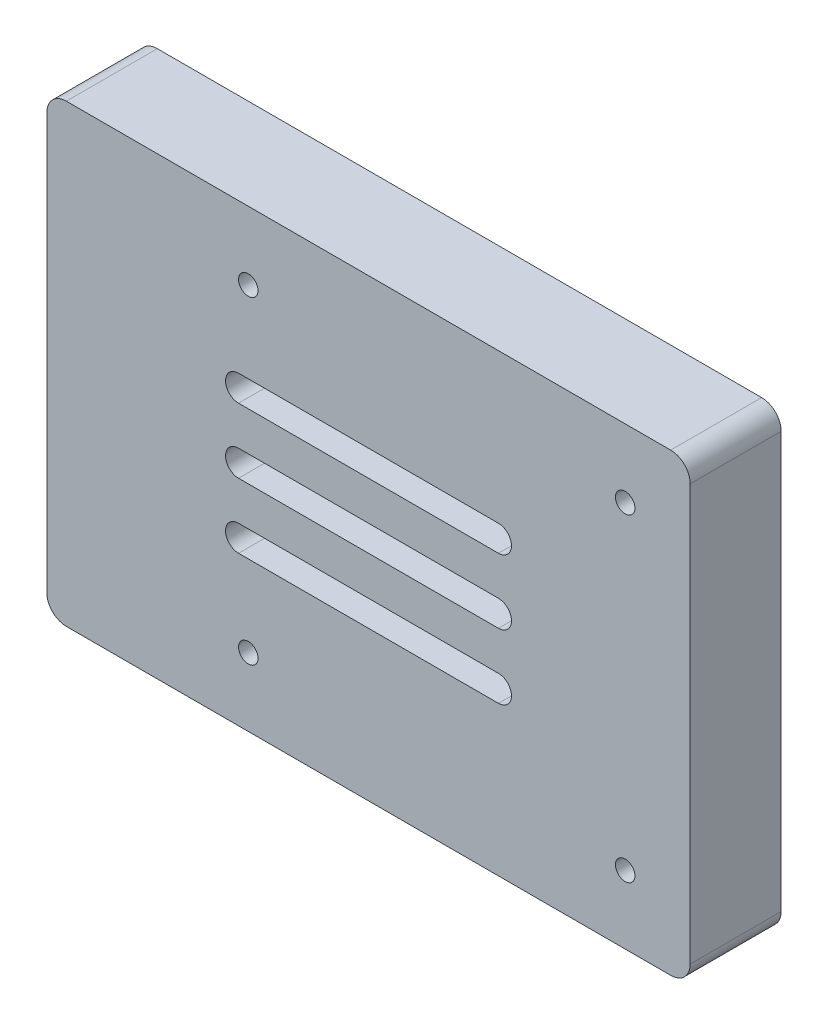
from build123d import *

# Parameters (mm, degrees)
BOSS_EXTRU_1_DEPTH      = 10
BOSS_EXTRU_2_START      = 10
BOSS_EXTRU_2_DEPTH      = 4
ESQUISSE3_R             = 1.5
ENL_V_MAT_EXTRU_1_DEPTH = 63.219369974
ENL_V_MAT_EXTRU_2_DEPTH = 5


with BuildPart() as part:
    # Esquisse1 → Boss.-Extru.1 (new body)
    with BuildSketch(Plane.XY):
        with BuildLine():
            Line((-46.5, -35), (46.5, -35))
            ThreePointArc((46.5, -35), (48.621320344, -34.121320344), (49.5, -32))
            Line((49.5, -32), (49.5, 32))
            ThreePointArc((49.5, 32), (48.621320344, 34.121320344), (46.5, 35))
            Line((46.5, 35), (-46.5, 35))
            ThreePointArc((-46.5, 35), (-48.621320344, 34.121320344), (-49.5, 32))
            Line((-49.5, 32), (-49.5, -32))
            ThreePointArc((-49.5, -32), (-48.621320344, -34.121320344), (-46.5, -35))
        make_face()
        with BuildLine():
            ThreePointArc((44.5, -33), (46.621320344, -32.121320344), (47.5, -30))
            Line((47.5, -30), (47.5, 30))
            ThreePointArc((47.5, 30), (46.621320344, 32.121320344), (44.5, 33))
            Line((44.5, 33), (-44.5, 33))
            ThreePointArc((-44.5, 33), (-46.621320344, 32.121320344), (-47.5, 30))
            Line((-47.5, 30), (-47.5, -30))
            ThreePointArc((-47.5, -30), (-46.621320344, -32.121320344), (-44.5, -33))
            Line((-44.5, -33), (44.5, -33))
        make_face(mode=Mode.SUBTRACT)
    extrude(amount=BOSS_EXTRU_1_DEPTH)

    # Esquisse2 → Boss.-Extru.2 (add)
    with BuildSketch(Plane.XY.offset(BOSS_EXTRU_2_START)):
        with BuildLine():
            Line((-46.5, -35), (46.5, -35))
            ThreePointArc((46.5, -35), (48.621320344, -34.121320344), (49.5, -32))
            Line((49.5, -32), (49.5, 32))
            ThreePointArc((49.5, 32), (48.621320344, 34.121320344), (46.5, 35))
            Line((46.5, 35), (-46.5, 35))
            ThreePointArc((-46.5, 35), (-48.621320344, 34.121320344), (-49.5, 32))
            Line((-49.5, 32), (-49.5, -32))
            ThreePointArc((-49.5, -32), (-48.621320344, -34.121320344), (-46.5, -35))
        make_face()
    extrude(amount=BOSS_EXTRU_2_DEPTH)

    # Esquisse3 → Enlèv. mat.-Extru.1 (cut, through all)
    with BuildSketch(Plane.XY.offset(14)):
        with Locations((39.5, 24.5)):
            Circle(ESQUISSE3_R)
        with Locations((-18.5, 24.5)):
            Circle(ESQUISSE3_R)
        with Locations((39.5, -24.5)):
            Circle(ESQUISSE3_R)
        with Locations((-18.5, -24.5)):
            Circle(ESQUISSE3_R)
    extrude(amount=-ENL_V_MAT_EXTRU_1_DEPTH, mode=Mode.SUBTRACT)

    # Esquisse4 → Enlèv. mat.-Extru.2 (cut)
    with BuildSketch(Plane.XY.offset(14)):
        with BuildLine():
            Line((20, -2), (-20, -2))
            ThreePointArc((-20, -2), (-22, 0), (-20, 2))
            Line((-20, 2), (20, 2))
            ThreePointArc((20, 2), (22, 0), (20, -2))
        make_face()
        with BuildLine():
            Line((20, -12), (-20, -12))
            ThreePointArc((-20, -12), (-22, -10), (-20, -8))
            Line((-20, -8), (20, -8))
            ThreePointArc((20, -8), (22, -10), (20, -12))
        make_face()
        with BuildLine():
            Line((20, 8), (-20, 8))
            ThreePointArc((-20, 8), (-22, 10), (-20, 12))
            Line((-20, 12), (20, 12))
            ThreePointArc((20, 12), (22, 10), (20, 8))
        make_face()
    extrude(amount=-ENL_V_MAT_EXTRU_2_DEPTH, mode=Mode.SUBTRACT)


solid = part.part
